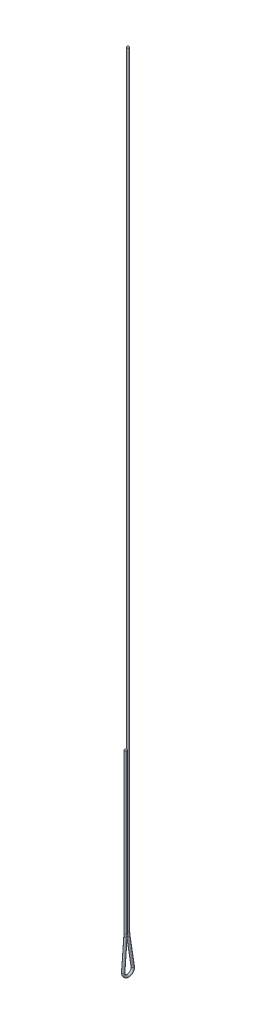
from build123d import *

# Parameters (mm, degrees)
SKETCH2_R = 0.75


with BuildPart() as part:
    # Sweep1: sweep along a path in Sketch1
    with BuildLine(Plane(origin=(0, 0, 0), x_dir=(0, 0, -1), z_dir=(1, 0, 0))) as sweep1_path:
        Line((0, 500), (0, 21.508533778))
        ThreePointArc((0, 21.508533778), (0.056650248, 20.004272941), (0.226280067, 18.508533778))
        Line((0.226280067, 18.508533778), (2.96605799, 0.45))
        ThreePointArc((2.96605799, 0.45), (0.112900451, -2.997874829), (-2.9915026, 0.225637305))
        Line((-2.9915026, 0.225637305), (-1.556649332, 19.248942344))
        ThreePointArc((-1.556649332, 19.248942344), (-1.514167351, 20.000533536), (-1.5, 20.753191044))
        Line((-1.5, 20.753191044), (-1.5, 120))
    # Sketch2 → Sweep1 (sweep)
    with BuildSketch(Plane(origin=(0, 120, 1.5), x_dir=(-1, 0, 0), z_dir=(0, 1, 0))):
        Circle(SKETCH2_R)
    sweep(path=sweep1_path.line)


solid = part.part
